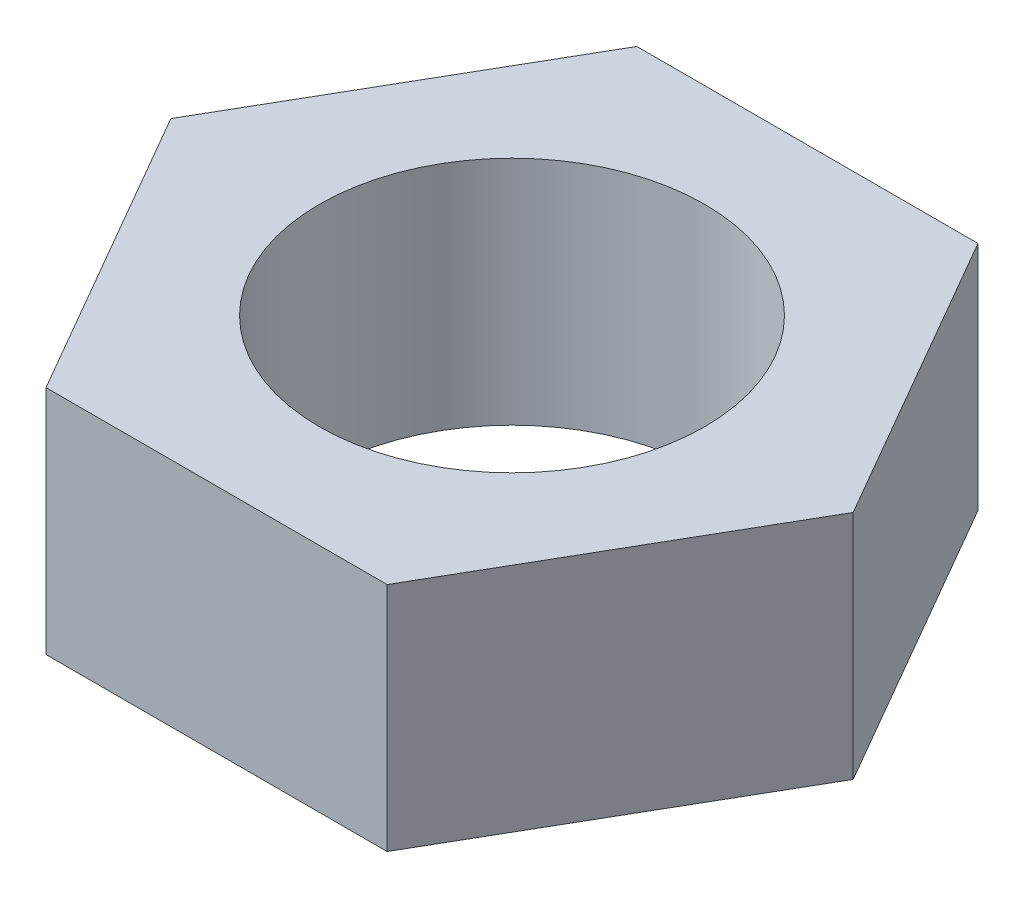
from build123d import *

# Parameters (mm, degrees)
SKETCH1_R           = 9.525
BOSS_EXTRUDE1_DEPTH = 11.43


with BuildPart() as part:
    # Sketch1 → Boss-Extrude1 (new body)
    with BuildSketch(Plane(origin=(0, 0, 0), x_dir=(1, 0, 0), z_dir=(0, 1, 0))):
        Polygon((16.864401363, 0), (8.432200682, 14.605), (-8.432200682, 14.605), (-16.864401363, 0), (-8.432200682, -14.605), (8.432200682, -14.605), align=None)
        with Locations(Location((0, 0, 0), (0, 0, 270))):
            Circle(SKETCH1_R, mode=Mode.SUBTRACT)
    extrude(amount=BOSS_EXTRUDE1_DEPTH)


solid = part.part
